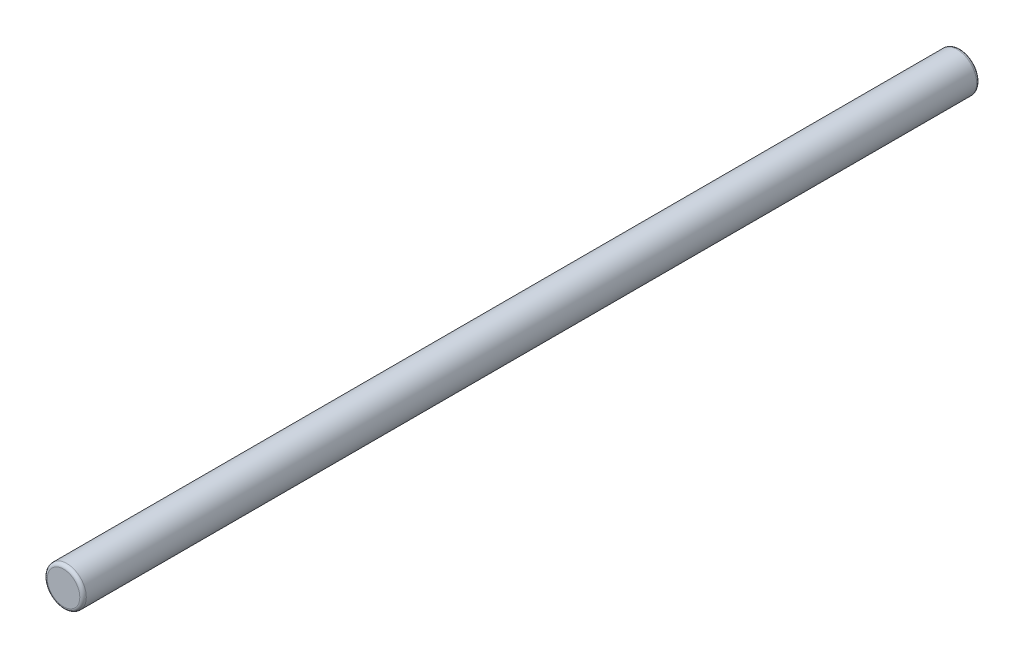
from build123d import *

# Parameters (mm, degrees)
ESBO_O1_R                = 3
RESSALTO_EXTRUS_O1_DEPTH = 138
FILETE1_R                = 0.5


with BuildPart() as part:
    # Esboço1 → Ressalto-extrusão1 (new body)
    with BuildSketch(Plane.XY):
        Circle(ESBO_O1_R)
    extrude(amount=RESSALTO_EXTRUS_O1_DEPTH)

    # Filete1
    filete1_edges = [part.edges().sort_by_distance(p)[0] for p in [
        (-3, 0, 0),
        (-3, 0, 138),
    ]]
    fillet(filete1_edges, radius=FILETE1_R)


solid = part.part
